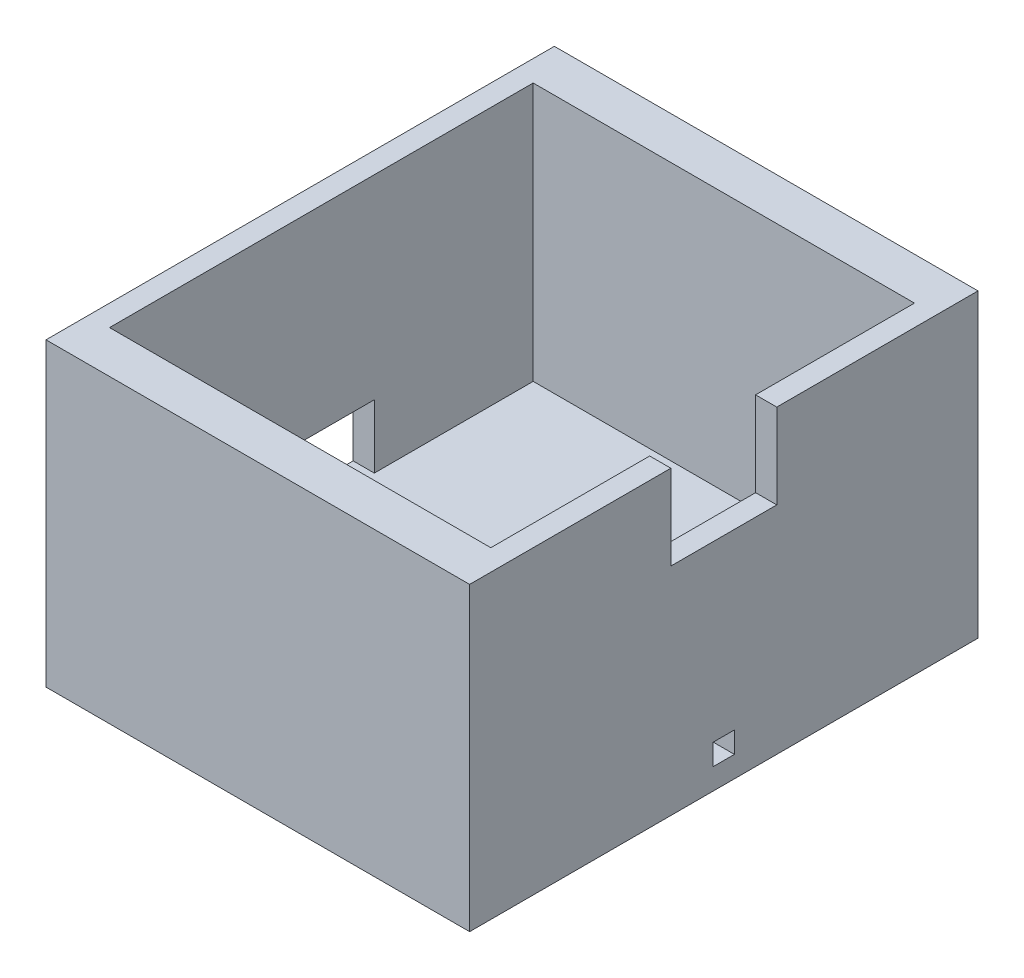
from build123d import *

# Parameters (mm, degrees)
SKETCH1_W           = 100
SKETCH1_H           = 120
BOSS_EXTRUDE1_DEPTH = 10
SKETCH2_W           = 100
SKETCH2_H           = 5
CUT_EXTRUDE1_DEPTH  = 5
SKETCH3_R           = 2
CUT_EXTRUDE2_DEPTH  = 10
SKETCH4_W           = 100
SKETCH4_H           = 120
SKETCH4_W_2         = 90
SKETCH4_H_2         = 100
BOSS_EXTRUDE2_DEPTH = 61
SKETCH5_W           = 25
SKETCH5_H           = 15
CUT_EXTRUDE3_DEPTH  = 29
SKETCH6_W           = 25
SKETCH6_H           = 20
CUT_EXTRUDE4_DEPTH  = 29


with BuildPart() as part:
    # Sketch1 → Boss-Extrude1 (new body)
    with BuildSketch(Plane(origin=(0, 0, 0), x_dir=(1, 0, 0), z_dir=(0, 1, 0))):
        Rectangle(SKETCH1_W, SKETCH1_H)
    extrude(amount=BOSS_EXTRUDE1_DEPTH)

    # Sketch2 → Cut-Extrude1 (cut)
    with BuildSketch(Plane(origin=(0, 10, 0), x_dir=(1, 0, 0), z_dir=(0, 1, 0))):
        Rectangle(SKETCH2_W, SKETCH2_H)
    extrude(amount=-CUT_EXTRUDE1_DEPTH, mode=Mode.SUBTRACT)

    # Sketch3 → Cut-Extrude2 (cut)
    with BuildSketch(Plane(origin=(0, 10, 0), x_dir=(1, 0, 0), z_dir=(0, 1, 0))):
        with Locations(Location((13.1, -18.726688176, 0), (0, 0, 270))):
            Circle(SKETCH3_R)
        with Locations(Location((-36.9, -18.726688176, 0), (0, 0, 270))):
            Circle(SKETCH3_R)
    extrude(amount=-CUT_EXTRUDE2_DEPTH, mode=Mode.SUBTRACT)

    # Sketch4 → Boss-Extrude2 (add)
    with BuildSketch(Plane(origin=(0, 10, 0), x_dir=(1, 0, 0), z_dir=(0, 1, 0))):
        Rectangle(SKETCH4_W, SKETCH4_H)
        Rectangle(SKETCH4_W_2, SKETCH4_H_2, mode=Mode.SUBTRACT)
    extrude(amount=BOSS_EXTRUDE2_DEPTH)

    # Sketch5 → Cut-Extrude3 (cut)
    with BuildSketch(Plane.ZY.offset(50)):
        with Locations((0, 17.5)):
            Rectangle(SKETCH5_W, SKETCH5_H)
    extrude(amount=-CUT_EXTRUDE3_DEPTH, mode=Mode.SUBTRACT)

    # Sketch6 → Cut-Extrude4 (cut)
    with BuildSketch(Plane(origin=(50, 0, 0), x_dir=(0, 0, -1), z_dir=(1, 0, 0))):
        with Locations((0, 61)):
            Rectangle(SKETCH6_W, SKETCH6_H)
    extrude(amount=-CUT_EXTRUDE4_DEPTH, mode=Mode.SUBTRACT)


solid = part.part
